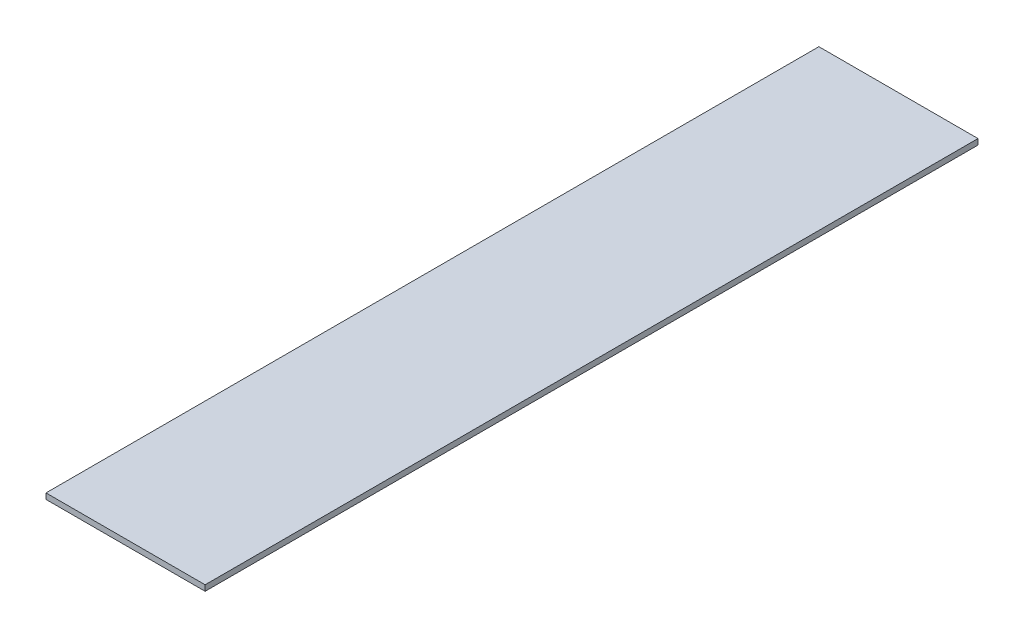
from build123d import *

# Parameters (mm, degrees)
KAPYAG_PC_KAPAK_GECMELI_1_START = -20
SKETCH1_W                       = 140
SKETCH1_H                       = 5
KAPYAG_PC_KAPAK_GECMELI_1_DEPTH = 680


with BuildPart() as part:
    # Sketch1 → KAPYAG_PC_kapak_gecmeli_1 (new body)
    with BuildSketch(Plane.XY.offset(KAPYAG_PC_KAPAK_GECMELI_1_START)):
        with Locations((0, 257.5)):
            Rectangle(SKETCH1_W, SKETCH1_H)
    extrude(amount=-KAPYAG_PC_KAPAK_GECMELI_1_DEPTH)


solid = part.part
